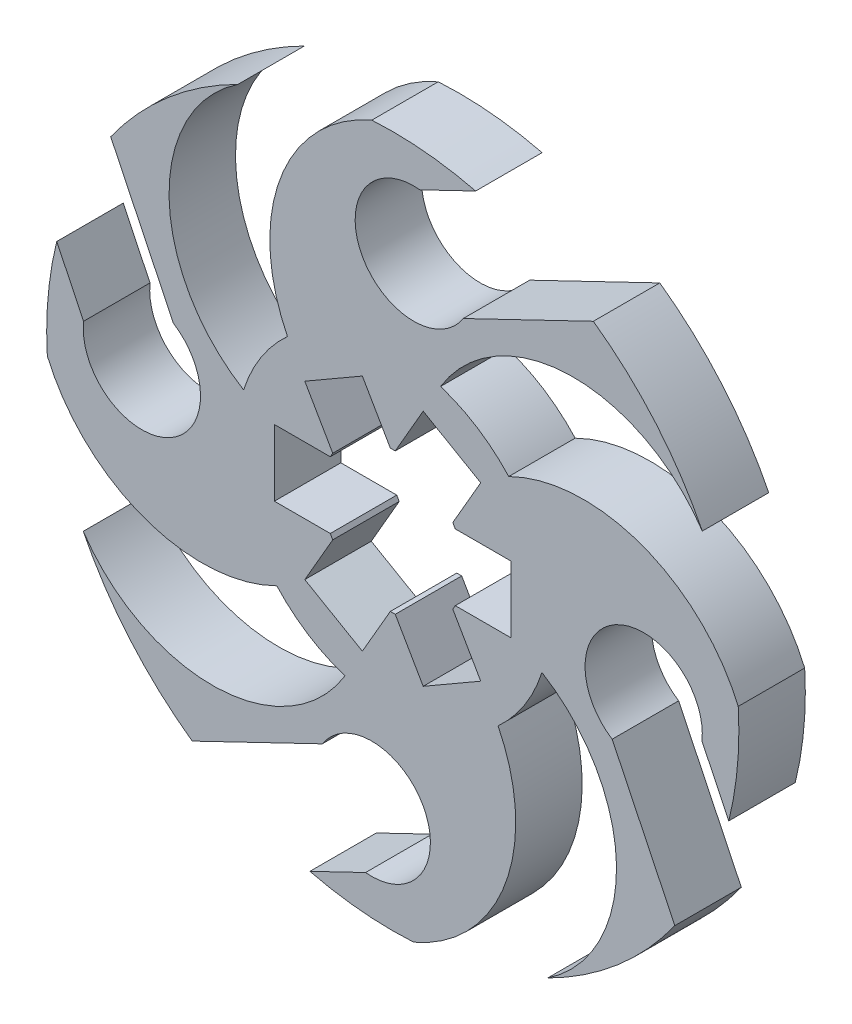
from build123d import *

# Parameters (mm, degrees)
BOSS_EXTRUDE1_DEPTH = 1.524


with BuildPart() as part:
    # Sketch1 → Boss-Extrude1 (new body)
    with BuildSketch(Plane.XY):
        with BuildLine():
            Line((105.591414647, -8.468455362), (106.869091272, -7.853190647))
            ThreePointArc((106.869091272, -7.853190647), (108.22238434, -5.932890961), (105.877274812, -5.793555702))
            Line((105.877274812, -5.793555702), (102.892707432, -7.23077304))
            ThreePointArc((102.892707432, -7.23077304), (101.464153001, -5.925516577), (100.393881735, -4.313380846))
            ThreePointArc((100.393881735, -4.313380846), (103.431247132, -5.892390693), (106.397273409, -4.183136826))
            ThreePointArc((106.397273409, -4.183136826), (105.549139909, -3.783076692), (104.83344904, -3.177135173))
            ThreePointArc((104.83344904, -3.177135173), (101.78471521, -3.345160226), (99.56970685, -1.24355409))
            ThreePointArc((99.56970685, -1.24355409), (99.587627406, -0.043990252), (99.786130504, 1.139171219))
            Line((99.786130504, 1.139171219), (100.401395219, -0.138505406))
            ThreePointArc((100.401395219, -0.138505406), (102.321694905, -1.491798474), (102.461030165, 0.853311054))
            Line((102.461030165, 0.853311054), (101.023812827, 3.837878434))
            ThreePointArc((101.023812827, 3.837878434), (102.32906929, 5.266432866), (103.941205021, 6.336704131))
            ThreePointArc((103.941205021, 6.336704131), (102.362195173, 3.299338734), (104.07144904, 0.333312457))
            ThreePointArc((104.07144904, 0.333312457), (104.471509175, 1.181445957), (105.077450693, 1.897136826))
            ThreePointArc((105.077450693, 1.897136826), (104.90942564, 4.945870656), (107.011031776, 7.160879016))
            ThreePointArc((107.011031776, 7.160879016), (108.210595614, 7.14295846), (109.393757085, 6.944455362))
            Line((109.393757085, 6.944455362), (108.11608046, 6.329190647))
            ThreePointArc((108.11608046, 6.329190647), (106.762787392, 4.408890961), (109.10789692, 4.269555702))
            Line((109.10789692, 4.269555702), (112.092464301, 5.70677304))
            ThreePointArc((112.092464301, 5.70677304), (113.521018732, 4.401516577), (114.591289997, 2.789380846))
            ThreePointArc((114.591289997, 2.789380846), (111.5539246, 4.368390693), (108.587898324, 2.659136826))
            ThreePointArc((108.587898324, 2.659136826), (109.436031823, 2.259076692), (110.151722693, 1.653135173))
            ThreePointArc((110.151722693, 1.653135173), (113.200456523, 1.821160226), (115.415464883, -0.28044591))
            ThreePointArc((115.415464883, -0.28044591), (115.397544326, -1.480009748), (115.199041228, -2.663171219))
            Line((115.199041228, -2.663171219), (114.583776513, -1.385494594))
            ThreePointArc((114.583776513, -1.385494594), (112.663476827, -0.032201526), (112.524141568, -2.377311054))
            Line((112.524141568, -2.377311054), (113.961358906, -5.361878434))
            ThreePointArc((113.961358906, -5.361878434), (112.656102443, -6.790432866), (111.043966712, -7.860704131))
            ThreePointArc((111.043966712, -7.860704131), (112.622976559, -4.823338734), (110.913722693, -1.857312457))
            ThreePointArc((110.913722693, -1.857312457), (110.513662558, -2.705445957), (109.907721039, -3.421136826))
            ThreePointArc((109.907721039, -3.421136826), (110.075746092, -6.469870656), (107.974139956, -8.684879016))
            ThreePointArc((107.974139956, -8.684879016), (106.774576118, -8.66695846), (105.591414647, -8.468455362))
        make_face()
        Polygon((110.207675722, 0), (110.207675722, -1.524), (108.925853356, -1.524), (108.869130969, -1.622246056), (109.510042152, -2.732336789), (108.190219437, -3.494336789), (107.549308253, -2.384246056), (107.435863479, -2.384246056), (106.794952296, -3.494336789), (105.47512958, -2.732336789), (106.116040764, -1.622246056), (106.059318377, -1.524), (104.77749601, -1.524), (104.77749601, 0), (106.059318377, 0), (106.116040764, 0.098246056), (105.47512958, 1.208336789), (106.794952296, 1.970336789), (107.435863479, 0.860246056), (107.549308253, 0.860246056), (108.190219437, 1.970336789), (109.510042152, 1.208336789), (108.869130969, 0.098246056), (108.925853356, 0), align=None, mode=Mode.SUBTRACT)
    extrude(amount=BOSS_EXTRUDE1_DEPTH)


solid = part.part
